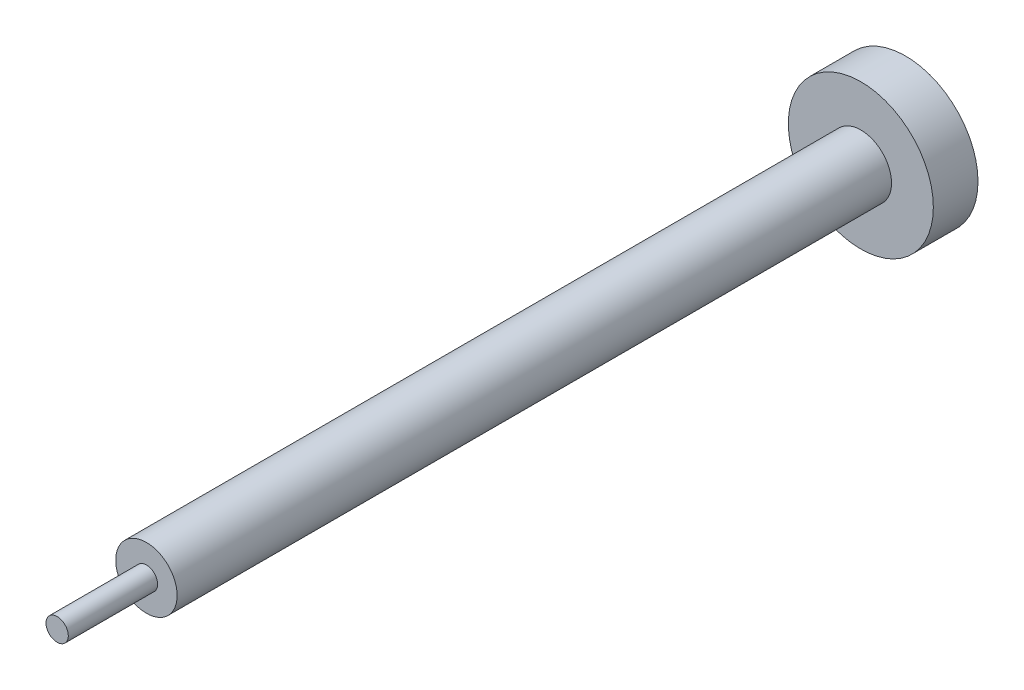
from build123d import *

# Parameters (mm, degrees)
SKETCH1_R           = 20.6248
BOSS_EXTRUDE1_DEPTH = 12.7
SKETCH2_R           = 8.73125
BOSS_EXTRUDE2_DEPTH = 203.2
SKETCH3_R           = 3.175
BOSS_EXTRUDE3_DEPTH = 25.4
SCALE1_SCALE        = 0.66


with BuildPart() as part:
    # Sketch1 → Boss-Extrude1 (new body)
    with BuildSketch(Plane.XY):
        Circle(SKETCH1_R)
    extrude(amount=-BOSS_EXTRUDE1_DEPTH)

    # Sketch2 → Boss-Extrude2 (add)
    with BuildSketch(Plane.XY):
        Circle(SKETCH2_R)
    extrude(amount=BOSS_EXTRUDE2_DEPTH)

    # Sketch3 → Boss-Extrude3 (add)
    with BuildSketch(Plane.XY.offset(203.2)):
        Circle(SKETCH3_R)
    extrude(amount=BOSS_EXTRUDE3_DEPTH)


with BuildPart() as part_1:
    # Scale1: scaled about (0, 0, 75.409153815)
    add(part.part.scale(SCALE1_SCALE).moved(Location((0, 0, 25.639112297))))


solid = part_1.part
